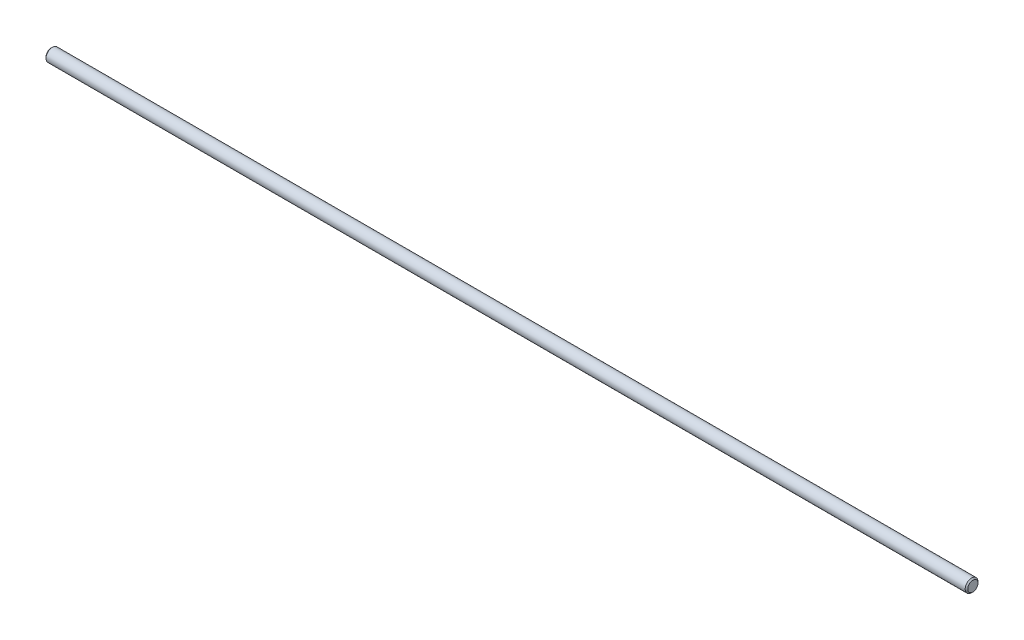
from build123d import *

# Parameters (mm, degrees)
EXTRUDE1_DEPTH      = 228.6
EXTRUDE1_DEPTH_BACK = 228.6
SKETCH2_R           = 3.175
CHAMFER1_SIZE       = 0.635


with BuildPart() as part:
    # Sketch2 → Extrude1 (new, two sides: drawn at the far end of the back side and taken through both)
    with BuildSketch(Plane(origin=(0, 0, 0), x_dir=(0, 0, -1), z_dir=(1, 0, 0)).offset(-EXTRUDE1_DEPTH_BACK)):
        Circle(SKETCH2_R)
    extrude(amount=EXTRUDE1_DEPTH + EXTRUDE1_DEPTH_BACK)

    # Chamfer1
    chamfer1_edges = [part.edges().sort_by_distance(p)[0] for p in [
        (-228.6, 0, 3.175),
        (228.6, 0, 3.175),
    ]]
    chamfer(chamfer1_edges, length=CHAMFER1_SIZE)


solid = part.part
